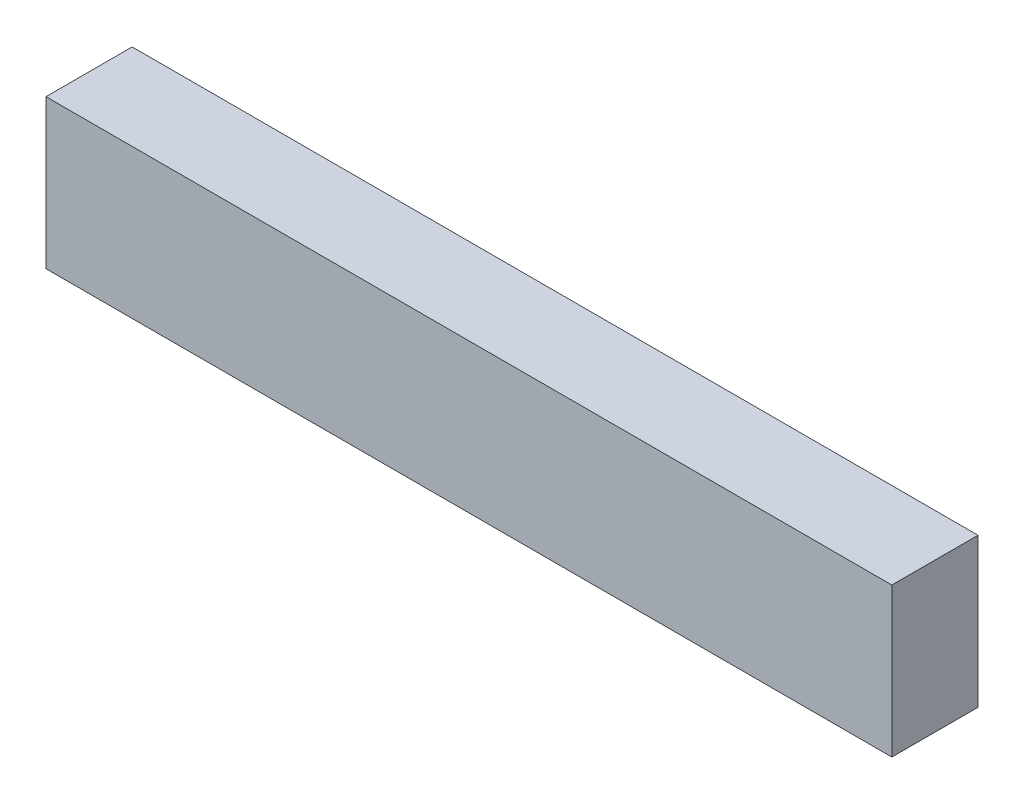
from build123d import *

# Parameters (mm, degrees)
SKETCH1_W                 = 71.17230149
SKETCH1_H                 = 12.54
BOSS_EXTRUDE1_DEPTH       = 7.25
SHELL1_T                  = -0.5
SHELL1_THICKNESS_2_FACE_W = 70.17230149
SHELL1_THICKNESS_2_FACE_H = 11.54
SHELL1_THICKNESS_2_DEPTH  = 0.3


with BuildPart() as part:
    # Sketch1 → Boss-Extrude1 (new body)
    with BuildSketch(Plane.XY):
        with Locations((43.450650745, 55.8)):
            Rectangle(SKETCH1_W, SKETCH1_H)
    extrude(amount=BOSS_EXTRUDE1_DEPTH)

    # Shell1
    shell1_openings = [part.faces().sort_by_distance(p)[0] for p in [
        (43.450650745, 55.8, 0),
    ]]
    offset(amount=SHELL1_T, openings=shell1_openings, kind=Kind.INTERSECTION)

    # Shell1 thickness 2 face (on inner face of the shell) → Shell1 thickness 2 (cut)
    with BuildSketch(Plane(origin=(43.450650745, 55.8, 6.75), x_dir=(1, 0, 0), z_dir=(0, 0, 1))):
        Rectangle(SHELL1_THICKNESS_2_FACE_W, SHELL1_THICKNESS_2_FACE_H)
    extrude(amount=SHELL1_THICKNESS_2_DEPTH, mode=Mode.SUBTRACT)


solid = part.part
